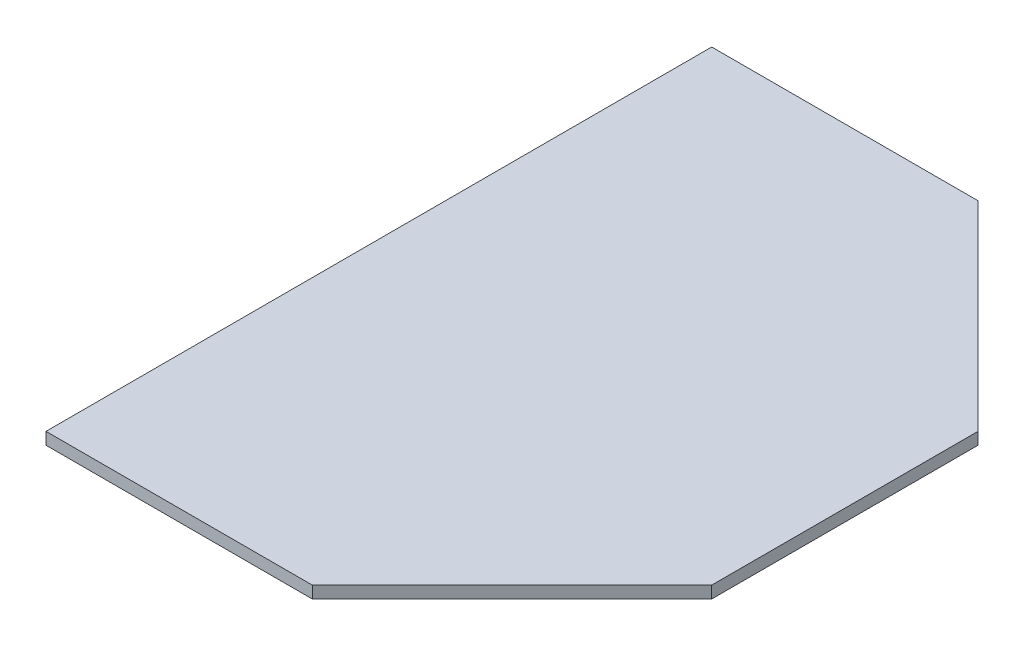
from build123d import *

# Parameters (mm, degrees)
SKETCH1_W           = 254
SKETCH1_H           = 254
BOSS_EXTRUDE1_DEPTH = 4.599999944
CUT_EXTRUDE2_DEPTH  = 360.239697138
CUT_EXTRUDE3_DEPTH  = 4.826
CUT_EXTRUDE5_DEPTH  = 4.826
CUT_EXTRUDE6_DEPTH  = 4.826
CUT_EXTRUDE7_DEPTH  = 360.239697138


with BuildPart() as part:
    # Sketch1 → Boss-Extrude1 (new body)
    with BuildSketch(Plane(origin=(0, 0, 0), x_dir=(1, 0, 0), z_dir=(0, 1, 0))):
        with Locations((127, 127)):
            Rectangle(SKETCH1_W, SKETCH1_H)
    extrude(amount=BOSS_EXTRUDE1_DEPTH)

    # Sketch4 → Cut-Extrude2 (cut, through all)
    with BuildSketch(Plane(origin=(0, 4.599999944, 0), x_dir=(1, 0, 0), z_dir=(0, 1, 0))):
        Polygon((76.2, 254), (0, 177.8), (0, 254), align=None)
    extrude(amount=-CUT_EXTRUDE2_DEPTH, mode=Mode.SUBTRACT)

    # Sketch5 → Cut-Extrude3 (cut)
    with BuildSketch(Plane(origin=(0, 4.599999944, 0), x_dir=(1, 0, 0), z_dir=(0, 1, 0))):
        Polygon((177.8, 254), (254, 177.8), (254, 254), align=None)
    extrude(amount=-CUT_EXTRUDE3_DEPTH, mode=Mode.SUBTRACT)

    # Sketch9 → Cut-Extrude5 (cut)
    with BuildSketch(Plane(origin=(0, 4.599999944, 0), x_dir=(1, 0, 0), z_dir=(0, 1, 0))):
        Polygon((0, 76.2), (0, 0), (76.2, 0), align=None)
    extrude(amount=-CUT_EXTRUDE5_DEPTH, mode=Mode.SUBTRACT)

    # Sketch11 → Cut-Extrude6 (cut)
    with BuildSketch(Plane(origin=(0, 4.599999944, 0), x_dir=(1, 0, 0), z_dir=(0, 1, 0))):
        Polygon((254, 76.2), (254, 0), (177.8, 0), align=None)
    extrude(amount=-CUT_EXTRUDE6_DEPTH, mode=Mode.SUBTRACT)

    # Sketch12 → Cut-Extrude7 (cut, through all)
    with BuildSketch(Plane.XZ):
        Polygon((76.2, 0), (76.2, -254), (0, -177.8), (0, -76.2), align=None)
    extrude(amount=-CUT_EXTRUDE7_DEPTH, mode=Mode.SUBTRACT)


solid = part.part
